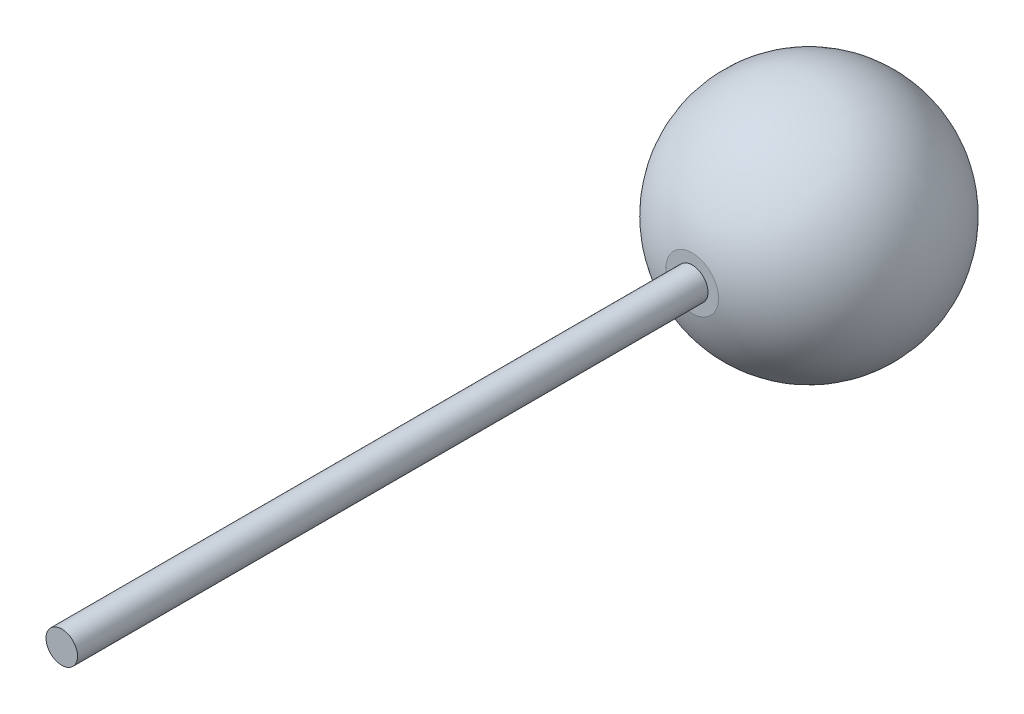
from build123d import *

# Parameters (mm, degrees)
SKETCH7_R           = 0.762
BOSS_EXTRUDE2_DEPTH = 30.48


with BuildPart() as part:
    # Sketch5 → Revolve9 (revolve)
    with BuildSketch(Plane(origin=(0, 0, 0), x_dir=(1, 0, 0), z_dir=(0, 1, 0))):
        with BuildLine():
            Line((0, 0), (1.27, 0))
            ThreePointArc((1.27, 0), (5.749721549, 6.283302394), (0, 11.43))
            Line((0, 11.43), (0, 0))
        make_face()
    revolve(axis=Axis((0, 0, -5.46059101), (0, 0, 1)))

    # Sketch7 → Boss-Extrude2 (add)
    with BuildSketch(Plane.XY):
        with Locations(Location((0, 0, 0), (0, 0, 180))):
            Circle(SKETCH7_R)
    extrude(amount=BOSS_EXTRUDE2_DEPTH)


solid = part.part
